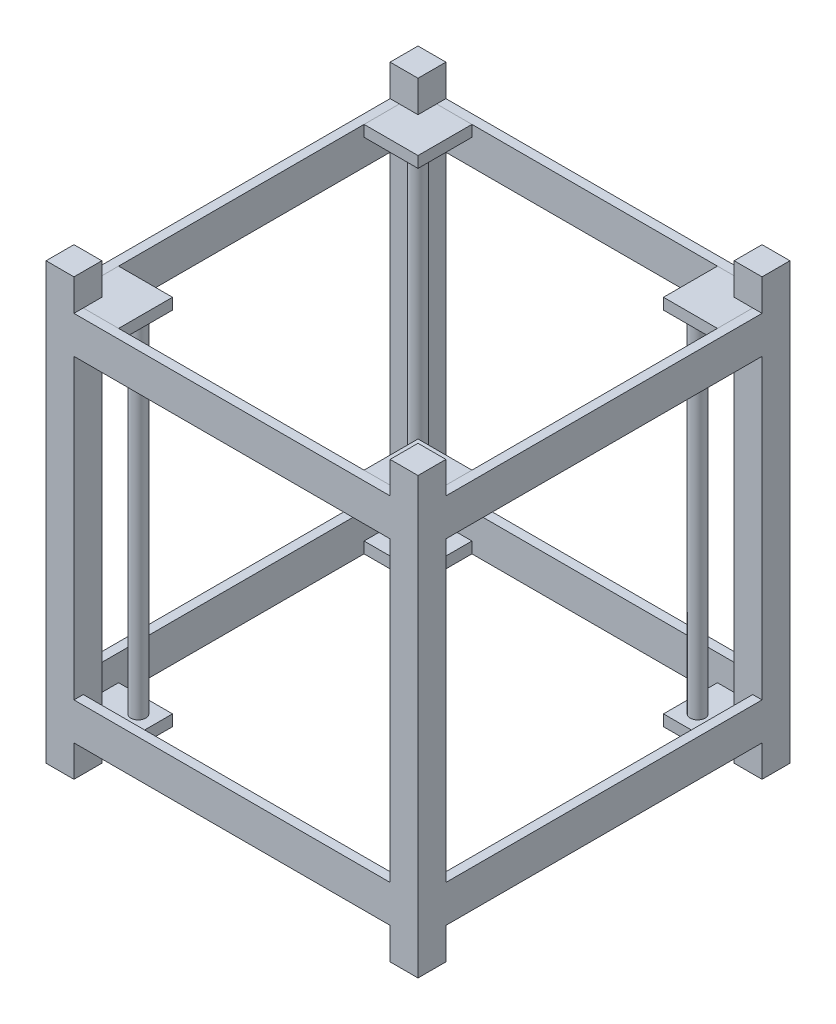
from build123d import *

# Parameters (mm, degrees)
BOSS_EXTRUDE1_DEPTH  = 10
SKETCH3_W            = 7.5
SKETCH3_H            = 7.5
BOSS_EXTRUDE2_DEPTH  = 40
SKETCH5_W            = 7.5
SKETCH5_H            = 7.5
BOSS_EXTRUDE8_DEPTH  = 8.5
BOSS_EXTRUDE9_DEPTH  = 3
SKETCH7_R            = 2
BOSS_EXTRUDE10_DEPTH = 47


with BuildPart() as part:
    # Sketch2 → Boss-Extrude1 (new body)
    with BuildSketch(Plane(origin=(0, 0, 0), x_dir=(1, 0, 0), z_dir=(0, 1, 0))):
        Polygon((-50, 50), (-42.5, 50), (0, 50), (42.5, 50), (50, 50), (50, 42.5), (50, 0), (50, -42.5), (50, -50), (42.5, -50), (0, -50), (-42.5, -50), (-50, -50), (-50, -42.5), (-50, 0), (-50, 42.5), align=None)
        Polygon((-42.5, 42.5), (-42.5, 47.5), (0, 47.5), (42.5, 47.5), (42.5, 42.5), (47.5, 42.5), (47.5, 0), (47.5, -42.5), (42.5, -42.5), (42.5, -47.5), (0, -47.5), (-42.5, -47.5), (-42.5, -42.5), (-47.5, -42.5), (-47.5, 0), (-47.5, 42.5), align=None, mode=Mode.SUBTRACT)
    extrude(amount=BOSS_EXTRUDE1_DEPTH)

    # Sketch3 → Boss-Extrude2 (add)
    with BuildSketch(Plane(origin=(0, 10, 0), x_dir=(1, 0, 0), z_dir=(0, 1, 0))):
        with Locations((46.25, 46.25)):
            Rectangle(SKETCH3_W, SKETCH3_H)
        with Locations((46.25, -46.25)):
            Rectangle(SKETCH3_W, SKETCH3_H)
        with Locations((-46.25, 46.25)):
            Rectangle(SKETCH3_W, SKETCH3_H)
        with Locations((-46.25, -46.25)):
            Rectangle(SKETCH3_W, SKETCH3_H)
    extrude(amount=BOSS_EXTRUDE2_DEPTH)

    # Sketch5 → Boss-Extrude8 (add)
    with BuildSketch(Plane.XZ):
        with Locations((46.25, -46.25)):
            Rectangle(SKETCH5_W, SKETCH5_H)
        with Locations((46.25, 46.25)):
            Rectangle(SKETCH5_W, SKETCH5_H)
        with Locations((-46.25, 46.25)):
            Rectangle(SKETCH5_W, SKETCH5_H)
        with Locations((-46.25, -46.25)):
            Rectangle(SKETCH5_W, SKETCH5_H)
    extrude(amount=BOSS_EXTRUDE8_DEPTH)


with BuildPart() as body_2:
    # Sketch6 → Boss-Extrude9 (new body)
    with BuildSketch(Plane.XZ):
        Polygon((42.5, -42.5), (47.5, -42.5), (47.5, -33), (33, -33), (33, -47.5), (42.5, -47.5), align=None)
    extrude(amount=-BOSS_EXTRUDE9_DEPTH)


with BuildPart() as body_3:
    # Sketch7 → Boss-Extrude10 (new body)
    with BuildSketch(Plane(origin=(0, 3, 0), x_dir=(1, 0, 0), z_dir=(0, 1, 0))):
        with Locations(Location((37.6, 37.6, 0), (0, 0, 90))):
            Circle(SKETCH7_R)
    extrude(amount=BOSS_EXTRUDE10_DEPTH)


with BuildPart() as body_4:
    # Mirror2: mirrored copy
    add(body_3.part.mirror(Plane(origin=(0, 0, 0), x_dir=(0, 0, 1), z_dir=(1, 0, 0))))


with BuildPart() as body_5:
    # Mirror2 2: mirrored copy
    add(body_2.part.mirror(Plane(origin=(0, 0, 0), x_dir=(0, 0, 1), z_dir=(1, 0, 0))))


with BuildPart() as body_6:
    # Mirror3: mirrored copy
    add(body_5.part.mirror(Plane.XY))


with BuildPart() as body_7:
    # Mirror3 2: mirrored copy
    add(body_4.part.mirror(Plane.XY))


with BuildPart() as body_8:
    # Mirror3 3: mirrored copy
    add(body_3.part.mirror(Plane.XY))


with BuildPart() as body_9:
    # Mirror3 4: mirrored copy
    add(body_2.part.mirror(Plane.XY))


with BuildPart() as body_10:
    # Mirror4: mirrored copy
    add(part.part.mirror(Plane(origin=(0, 50, 0), x_dir=(0, 0, 1), z_dir=(0, -1, 0))))

    # Combine1: union part
    add(part.part)


with BuildPart() as body_11:
    # Mirror4 2: mirrored copy
    add(body_7.part.mirror(Plane(origin=(0, 50, 0), x_dir=(0, 0, 1), z_dir=(0, -1, 0))))


with BuildPart() as body_12:
    # Mirror4 3: mirrored copy
    add(body_6.part.mirror(Plane(origin=(0, 50, 0), x_dir=(0, 0, 1), z_dir=(0, -1, 0))))


with BuildPart() as body_13:
    # Mirror4 4: mirrored copy
    add(body_5.part.mirror(Plane(origin=(0, 50, 0), x_dir=(0, 0, 1), z_dir=(0, -1, 0))))


with BuildPart() as body_14:
    # Mirror4 5: mirrored copy
    add(body_4.part.mirror(Plane(origin=(0, 50, 0), x_dir=(0, 0, 1), z_dir=(0, -1, 0))))


with BuildPart() as body_15:
    # Mirror4 6: mirrored copy
    add(body_3.part.mirror(Plane(origin=(0, 50, 0), x_dir=(0, 0, 1), z_dir=(0, -1, 0))))


with BuildPart() as body_16:
    # Mirror4 7: mirrored copy
    add(body_2.part.mirror(Plane(origin=(0, 50, 0), x_dir=(0, 0, 1), z_dir=(0, -1, 0))))


with BuildPart() as body_17:
    # Mirror4 8: mirrored copy
    add(body_9.part.mirror(Plane(origin=(0, 50, 0), x_dir=(0, 0, 1), z_dir=(0, -1, 0))))


with BuildPart() as body_18:
    # Mirror4 9: mirrored copy
    add(body_8.part.mirror(Plane(origin=(0, 50, 0), x_dir=(0, 0, 1), z_dir=(0, -1, 0))))

    # Combine5: union body 8
    add(body_8.part)


with BuildPart() as body_7_1:
    add(body_7.part)

    # Combine2: union body 11
    add(body_11.part)


with BuildPart() as body_4_1:
    add(body_4.part)

    # Combine3: union body 14
    add(body_14.part)


with BuildPart() as body_3_1:
    add(body_3.part)

    # Combine4: union body 15
    add(body_15.part)


with BuildPart() as body_2_1:
    add(body_2.part)

    # Combine6: union body 3, body 16
    add(body_3_1.part)
    add(body_16.part)


with BuildPart() as body_5_1:
    add(body_5.part)

    # Combine7: union body 4, body 13
    add(body_4_1.part)
    add(body_13.part)


with BuildPart() as body_6_1:
    add(body_6.part)

    # Combine8: union body 7, body 12
    add(body_7_1.part)
    add(body_12.part)


with BuildPart() as body_17_1:
    add(body_17.part)

    # Combine9: union body 9, body 18
    add(body_9.part)
    add(body_18.part)


solid = Compound([body_10.part, body_2_1.part, body_5_1.part, body_6_1.part, body_17_1.part])
